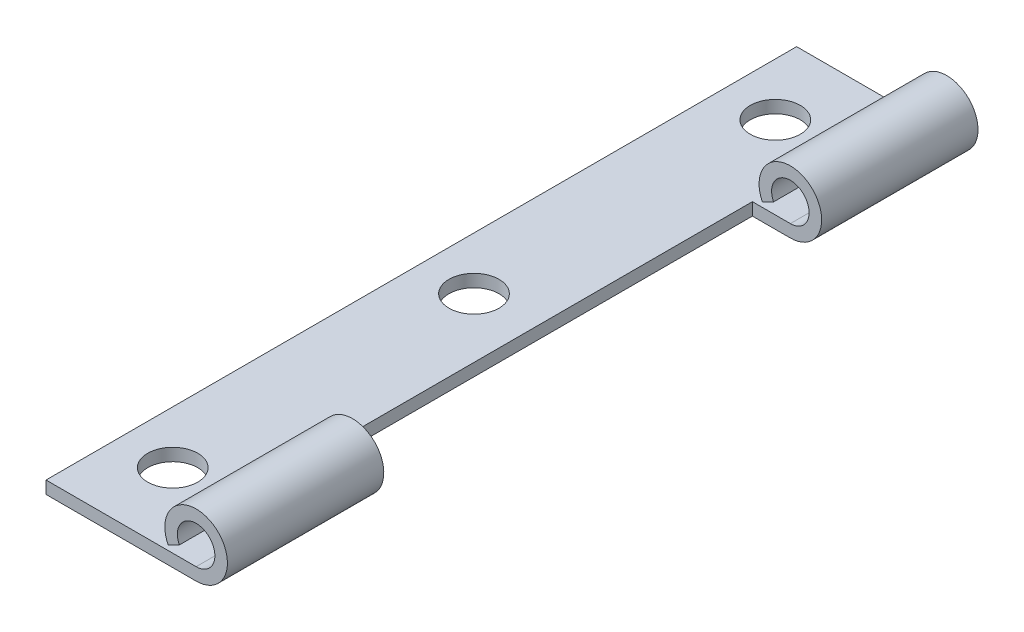
from build123d import *

# Parameters (mm, degrees)
SKETCH3_W          = 60
SKETCH3_H          = 1
SKETCH4_W          = 6.07081849
SKETCH4_H          = 35
CUT_EXTRUDE1_DEPTH = 62.929395282
SKETCH5_R          = 2
CUT_EXTRUDE2_DEPTH = 62.85668921


with BuildPart() as part:
    # Sweep1: sweep along a path in Sketch1
    with BuildLine(Plane.XY) as sweep1_path:
        Line((0, 0), (12, 0))
        ThreePointArc((12, 0), (13.315747679, 4.62574882), (9.762440739, 1.384953564))
    # Sketch3 → Sweep1 (sweep)
    with BuildSketch(Plane(origin=(0, 0, 0), x_dir=(0, 0, -1), z_dir=(1, 0, 0))):
        with Locations((-30, 0.5)):
            Rectangle(SKETCH3_W, SKETCH3_H)
    sweep(path=sweep1_path.line)

    # Sketch4 → Cut-Extrude1 (cut, through all)
    with BuildSketch(Plane(origin=(0, 0, 0), x_dir=(-1, 0, 0), z_dir=(0, -1, 0))):
        with Locations((-12, -30)):
            Rectangle(SKETCH4_W, SKETCH4_H)
    extrude(amount=-CUT_EXTRUDE1_DEPTH, mode=Mode.SUBTRACT)

    # Sketch5 → Cut-Extrude2 (cut, through all)
    with BuildSketch(Plane(origin=(0, 1, 0), x_dir=(1, 0, 0), z_dir=(0, 1, 0))):
        with Locations(Location((4.212926144, -5.917287591, 0), (0, 0, 270))):
            Circle(SKETCH5_R)
        with Locations(Location((4.212926144, -54.082712409, 0), (0, 0, 90))):
            Circle(SKETCH5_R)
        with Locations(Location((4.212926144, -30, 0), (0, 0, 270))):
            Circle(SKETCH5_R)
    extrude(amount=-CUT_EXTRUDE2_DEPTH, mode=Mode.SUBTRACT)


solid = part.part
